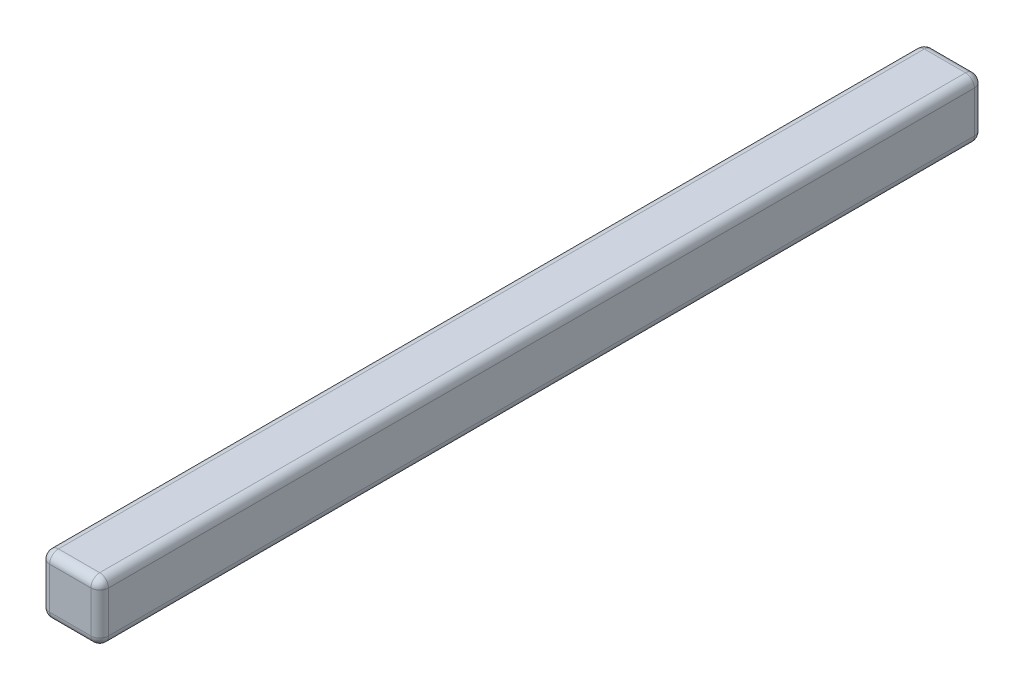
from build123d import *

# Parameters (mm, degrees)
SKETCH_1_W      = 20
SKETCH_1_H      = 20.100059678
EXTRUDE_1_DEPTH = 300
FILLET_1_R      = 3


with BuildPart() as part:
    # 草图1 → 凸台-拉伸1 (new body)
    with BuildSketch(Plane.XY):
        with Locations((50, 21.074970161)):
            Rectangle(SKETCH_1_W, SKETCH_1_H)
    extrude(amount=EXTRUDE_1_DEPTH)

    # 圆角1
    fillet_1_edges = [part.edges().sort_by_distance(p)[0] for p in [
        (60, 21.074970161, 300),
        (50, 31.125, 300),
        (40, 21.074970161, 300),
        (50, 31.125, 0),
        (60, 21.074970161, 0),
        (50, 11.024940322, 0),
        (40, 21.074970161, 0),
        (50, 11.024940322, 300),
        (40, 31.125, 150),
        (60, 31.125, 150),
        (60, 11.024940322, 150),
        (40, 11.024940322, 150),
    ]]
    fillet(fillet_1_edges, radius=FILLET_1_R)


solid = part.part
